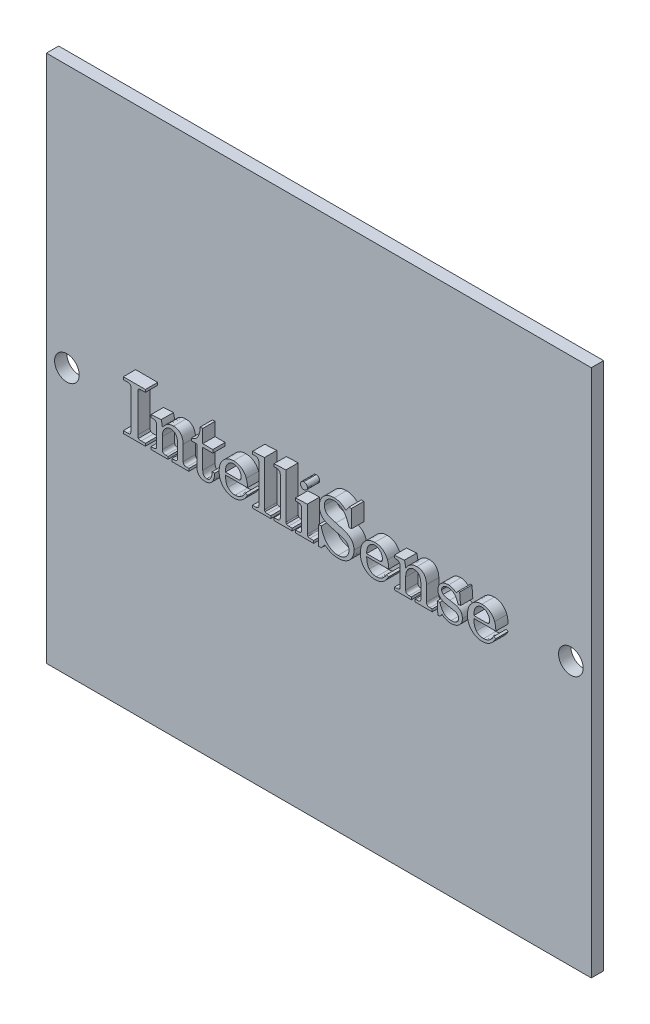
from build123d import *

# Parameters (mm, degrees)
SKETCH1_W           = 66.5
SKETCH1_H           = 64.5
BOSS_EXTRUDE2_DEPTH = 1.5
SKETCH3_R           = 1.5
CUT_EXTRUDE1_DEPTH  = 1.5
BOSS_EXTRUDE3_DEPTH = 1.5


with BuildPart() as part:
    # Sketch1 → Boss-Extrude2 (new body)
    with BuildSketch(Plane.XY):
        Rectangle(SKETCH1_W, SKETCH1_H)
    extrude(amount=BOSS_EXTRUDE2_DEPTH)

    # Sketch3 → Cut-Extrude1 (cut)
    with BuildSketch(Plane.XY.offset(1.5)):
        with Locations((30.75, 0)):
            Circle(SKETCH3_R)
        with Locations((-30.75, 0.23)):
            Circle(SKETCH3_R)
    extrude(amount=-CUT_EXTRUDE1_DEPTH, mode=Mode.SUBTRACT)

    # Sketch4 → Boss-Extrude3 (add)
    # profile 1 of 13: a face of its own
    with BuildSketch(Plane.XY.offset(1.5)):
        with BuildLine():
            Line((-22.363365787, 4.238702658), (-19.671058095, 4.238702658))
            Line((-19.671058095, 4.238702658), (-19.671058095, 3.93101035))
            Line((-19.671058095, 3.93101035), (-20.128990787, 3.93101035))
            add(Edge.make_bspline(
                [(-20.128990787, 3.93101035), (-20.175098097, 3.930262772), (-20.258381223, 3.928912431), (-20.370121238, 3.915820901), (-20.454893023, 3.892736701), (-20.5175512, 3.855995686), (-20.554844239, 3.797873105), (-20.576990501, 3.722906558), (-20.592568436, 3.627542706), (-20.593580414, 3.556489039), (-20.594135018, 3.517548812)],
                knots=[0, 0, 0, 0, 1.473035235, 2.660727346, 3.584016889, 4.269332832, 4.922698946, 5.732321762, 6.757222385, 8, 8, 8, 8], degree=3))
            Line((-20.594135018, 3.517548812), (-20.594135018, -1.019710804))
            add(Edge.make_bspline(
                [(-20.594135018, -1.019710804), (-20.593382305, -1.060684287), (-20.59201952, -1.134866767), (-20.579004957, -1.232769879), (-20.561372788, -1.309424417), (-20.534656268, -1.344739936), (-20.523221556, -1.359855034)],
                knots=[0, 0, 0, 0, 1.387279159, 2.511668523, 3.362991788, 4, 4, 4, 4], degree=3))
            add(Edge.make_bspline(
                [(-20.523221556, -1.359855034), (-20.505044708, -1.374609061), (-20.465743042, -1.406509963), (-20.386587808, -1.432677109), (-20.291372878, -1.451263989), (-20.221277605, -1.452779252), (-20.183077325, -1.453605034)],
                knots=[0, 0, 0, 0, 0.773484526, 1.672414867, 2.731520698, 4, 4, 4, 4], degree=3))
            Line((-20.183077325, -1.453605034), (-19.671058095, -1.453605034))
            Line((-19.671058095, -1.453605034), (-19.671058095, -1.761297342))
            Line((-19.671058095, -1.761297342), (-22.363365787, -1.761297342))
            Line((-22.363365787, -1.761297342), (-22.363365787, -1.453605034))
            Line((-22.363365787, -1.453605034), (-21.860961941, -1.453605034))
            add(Edge.make_bspline(
                [(-21.860961941, -1.453605034), (-21.820835773, -1.453020664), (-21.747817775, -1.45195728), (-21.649392377, -1.436761244), (-21.57312472, -1.413386537), (-21.514341691, -1.376304396), (-21.479784986, -1.315339668), (-21.455506293, -1.237434178), (-21.442463585, -1.135881377), (-21.441061798, -1.060999888), (-21.440288864, -1.019710804)],
                knots=[0, 0, 0, 0, 1.323224596, 2.407885381, 3.273374914, 3.948198526, 4.637756618, 5.528332226, 6.637141158, 8, 8, 8, 8], degree=3))
            Line((-21.440288864, -1.019710804), (-21.440288864, 3.517548812))
            add(Edge.make_bspline(
                [(-21.440288864, 3.517548812), (-21.441274414, 3.556877937), (-21.443040178, 3.6273421), (-21.453341579, 3.72066522), (-21.473310835, 3.791554393), (-21.499129004, 3.823717327), (-21.510000402, 3.83726035)],
                knots=[0, 0, 0, 0, 1.411879347, 2.529598496, 3.380849948, 4, 4, 4, 4], degree=3))
            add(Edge.make_bspline(
                [(-21.510000402, 3.83726035), (-21.531487043, 3.851950673), (-21.578929159, 3.88438664), (-21.67093263, 3.912266983), (-21.783842396, 3.927952688), (-21.866495257, 3.929933283), (-21.91144271, 3.93101035)],
                knots=[0, 0, 0, 0, 0.741247183, 1.636660366, 2.714792252, 4, 4, 4, 4], degree=3))
            Line((-21.91144271, 3.93101035), (-22.363365787, 3.93101035))
            Line((-22.363365787, 3.93101035), (-22.363365787, 4.238702658))
        make_face()
    # profile 2 of 13: a face of its own
    with BuildSketch(Plane.XY.offset(1.5)):
        with BuildLine():
            Line((-18.978750402, 1.93101035), (-17.747981171, 2.007933427))
            add(Edge.make_bspline(
                [(-17.747981171, 2.007933427), (-17.730872836, 1.951627318), (-17.695591554, 1.835511303), (-17.654393941, 1.651889456), (-17.619212783, 1.454594896), (-17.602669816, 1.317728051), (-17.594135018, 1.24711612)],
                knots=[0, 0, 0, 0, 0.90801977, 1.87254349, 2.90240903, 4, 4, 4, 4], degree=3))
            add(Edge.make_bspline(
                [(-17.594135018, 1.24711612), (-17.552082509, 1.313982974), (-17.470628539, 1.443501308), (-17.325318288, 1.613284864), (-17.172599667, 1.760077694), (-17.00635182, 1.879326052), (-16.827892367, 1.971133478), (-16.638951727, 2.038281809), (-16.438275075, 2.077224132), (-16.301032591, 2.082281498), (-16.231154248, 2.084856504)],
                knots=[0, 0, 0, 0, 1.126932948, 2.182822534, 3.182747156, 4.146717341, 5.093755211, 6.040378001, 7.002239436, 8, 8, 8, 8], degree=3))
            add(Edge.make_bspline(
                [(-16.231154248, 2.084856504), (-16.171780056, 2.082894645), (-16.057612528, 2.079122288), (-15.893032813, 2.053607873), (-15.744310139, 2.005717333), (-15.608140725, 1.942501594), (-15.486862583, 1.856193411), (-15.379436137, 1.748798204), (-15.283142193, 1.620976581), (-15.203377035, 1.472455081), (-15.137275198, 1.309327616), (-15.089078671, 1.134814105), (-15.061287435, 0.950333111), (-15.057570332, 0.824533395), (-15.055673479, 0.760337273)],
                knots=[0, 0, 0, 0, 1.066742861, 2.051184042, 2.979875827, 3.865162546, 4.737808188, 5.638610899, 6.584326065, 7.602165992, 8.658000152, 9.740577109, 10.847007032, 12, 12, 12, 12], degree=3))
            Line((-15.055673479, 0.760337273), (-15.055673479, -1.074999265))
            add(Edge.make_bspline(
                [(-15.055673479, -1.074999265), (-15.054708032, -1.106750815), (-15.052905194, -1.166042403), (-15.035072336, -1.248080419), (-15.005594635, -1.316204799), (-14.961420742, -1.370299723), (-14.901153161, -1.407921783), (-14.827820617, -1.435746452), (-14.738093964, -1.45011641), (-14.673503423, -1.452381332), (-14.638606171, -1.453605034)],
                knots=[0, 0, 0, 0, 1.162474339, 2.170758554, 3.057985272, 3.860866192, 4.687699209, 5.631348506, 6.720254899, 8, 8, 8, 8], degree=3))
            Line((-14.638606171, -1.453605034), (-14.363365787, -1.453605034))
            Line((-14.363365787, -1.453605034), (-14.363365787, -1.761297342))
            Line((-14.363365787, -1.761297342), (-16.440288864, -1.761297342))
            Line((-16.440288864, -1.761297342), (-16.440288864, -1.453605034))
            Line((-16.440288864, -1.453605034), (-16.243173479, -1.453605034))
            add(Edge.make_bspline(
                [(-16.243173479, -1.453605034), (-16.200598166, -1.453184861), (-16.121861826, -1.452407817), (-16.014545604, -1.434563956), (-15.925614792, -1.412202688), (-15.857736688, -1.373318305), (-15.806322888, -1.324558016), (-15.77315147, -1.263800939), (-15.751490381, -1.193833044), (-15.749198346, -1.143693139), (-15.747981171, -1.117066573)],
                knots=[0, 0, 0, 0, 1.487387907, 2.75068983, 3.80233843, 4.675424954, 5.458775713, 6.250117506, 7.070732924, 8, 8, 8, 8], degree=3))
            Line((-15.747981171, -1.117066573), (-15.747981171, 0.487500735))
            add(Edge.make_bspline(
                [(-15.747981171, 0.487500735), (-15.748425436, 0.529577436), (-15.74928927, 0.611392041), (-15.756405204, 0.729731676), (-15.768433535, 0.839625852), (-15.784473513, 0.941049579), (-15.808020223, 1.033455306), (-15.833528329, 1.118422453), (-15.866075919, 1.194260023), (-15.891838674, 1.240499049), (-15.904231171, 1.26274112)],
                knots=[0, 0, 0, 0, 1.262126943, 2.454099634, 3.554328132, 4.577771621, 5.530919515, 6.412754846, 7.236497351, 8, 8, 8, 8], degree=3))
            add(Edge.make_bspline(
                [(-15.904231171, 1.26274112), (-15.922741658, 1.291319169), (-15.959019258, 1.347327588), (-16.024873847, 1.420993133), (-16.09705332, 1.484433721), (-16.177650696, 1.535131059), (-16.264735023, 1.575496754), (-16.359281713, 1.602456713), (-16.460474766, 1.619995937), (-16.530354826, 1.62218569), (-16.566490787, 1.623318043)],
                knots=[0, 0, 0, 0, 1.03066891, 2.019946639, 2.98408736, 3.934053301, 4.895820513, 5.883307963, 6.905428821, 8, 8, 8, 8], degree=3))
            add(Edge.make_bspline(
                [(-16.566490787, 1.623318043), (-16.602611551, 1.622115702), (-16.673252766, 1.619764289), (-16.777057386, 1.602630105), (-16.876036519, 1.573289112), (-16.971103635, 1.534022706), (-17.061324763, 1.482493953), (-17.147024899, 1.419824247), (-17.227368178, 1.344600356), (-17.303127959, 1.259659415), (-17.370735123, 1.164907223), (-17.431609156, 1.063666359), (-17.482212449, 0.954851686), (-17.52254028, 0.839062202), (-17.555538907, 0.717083141), (-17.578052439, 0.587957677), (-17.591219429, 0.451718894), (-17.593147864, 0.35852396), (-17.594135018, 0.310818043)],
                knots=[0, 0, 0, 0, 0.931189644, 1.821123375, 2.703772069, 3.588232564, 4.46724645, 5.376399842, 6.319433391, 7.300026525, 8.306400874, 9.31626867, 10.342281956, 11.394383618, 12.474415394, 13.597083543, 14.769961734, 16, 16, 16, 16], degree=3))
            Line((-17.594135018, 0.310818043), (-17.594135018, -1.077403111))
            add(Edge.make_bspline(
                [(-17.594135018, -1.077403111), (-17.593170375, -1.109143231), (-17.591380928, -1.168022332), (-17.573686606, -1.249988425), (-17.542626214, -1.317104918), (-17.498618952, -1.371869137), (-17.437600447, -1.409086218), (-17.363131749, -1.43520498), (-17.273553972, -1.452059203), (-17.208401132, -1.45306543), (-17.173461941, -1.453605034)],
                knots=[0, 0, 0, 0, 1.160250848, 2.152308349, 3.044003165, 3.845348396, 4.682874384, 5.619572326, 6.723459812, 8, 8, 8, 8], degree=3))
            Line((-17.173461941, -1.453605034), (-16.901827325, -1.453605034))
            Line((-16.901827325, -1.453605034), (-16.901827325, -1.761297342))
            Line((-16.901827325, -1.761297342), (-18.978750402, -1.761297342))
            Line((-18.978750402, -1.761297342), (-18.978750402, -1.453605034))
            Line((-18.978750402, -1.453605034), (-18.705913864, -1.453605034))
            add(Edge.make_bspline(
                [(-18.705913864, -1.453605034), (-18.673812243, -1.452753075), (-18.612852427, -1.451135236), (-18.527693212, -1.437408849), (-18.454499277, -1.413165589), (-18.393891795, -1.379878913), (-18.346359872, -1.338548848), (-18.310651186, -1.292041559), (-18.291176465, -1.238665229), (-18.288026425, -1.201737923), (-18.28644271, -1.183172342)],
                knots=[0, 0, 0, 0, 1.384249069, 2.62863887, 3.705237652, 4.695576092, 5.589717584, 6.405434851, 7.198316037, 8, 8, 8, 8], degree=3))
            Line((-18.28644271, -1.183172342), (-18.28644271, 1.152164196))
            add(Edge.make_bspline(
                [(-18.28644271, 1.152164196), (-18.28797039, 1.188763155), (-18.290862108, 1.258040677), (-18.314704539, 1.355277786), (-18.356051566, 1.43817461), (-18.414486371, 1.505717621), (-18.486890067, 1.560438488), (-18.575532491, 1.596592279), (-18.677034284, 1.620254854), (-18.749430675, 1.622259764), (-18.787644633, 1.623318043)],
                knots=[0, 0, 0, 0, 1.11888944, 2.117926075, 3.03900458, 3.925918627, 4.828204364, 5.789209299, 6.83304868, 8, 8, 8, 8], degree=3))
            Line((-18.787644633, 1.623318043), (-18.978750402, 1.623318043))
            Line((-18.978750402, 1.623318043), (-18.978750402, 1.93101035))
        make_face()
    # profile 3 of 13: a face of its own
    with BuildSketch(Plane.XY.offset(1.5)):
        with BuildLine():
            Line((-12.978750402, 3.623318043), (-12.671058095, 3.623318043))
            Line((-12.671058095, 3.623318043), (-12.671058095, 2.007933427))
            Line((-12.671058095, 2.007933427), (-11.440288864, 2.007933427))
            Line((-11.440288864, 2.007933427), (-11.440288864, 1.623318043))
            Line((-11.440288864, 1.623318043), (-12.671058095, 1.623318043))
            Line((-12.671058095, 1.623318043), (-12.671058095, -0.80336465))
            add(Edge.make_bspline(
                [(-12.671058095, -0.80336465), (-12.669730506, -0.852771666), (-12.667215211, -0.946379849), (-12.640896836, -1.078155421), (-12.596479584, -1.192041511), (-12.535089112, -1.287491387), (-12.458694509, -1.361386017), (-12.371948034, -1.415211369), (-12.275017764, -1.447451781), (-12.206954104, -1.451527512), (-12.172260018, -1.453605034)],
                knots=[0, 0, 0, 0, 1.286365923, 2.437191868, 3.482267608, 4.455333307, 5.370964169, 6.228746245, 7.097138898, 8, 8, 8, 8], degree=3))
            add(Edge.make_bspline(
                [(-12.172260018, -1.453605034), (-12.130103034, -1.450763893), (-12.046640026, -1.44513896), (-11.927977871, -1.394036548), (-11.820532361, -1.313397192), (-11.74181013, -1.222818738), (-11.685448906, -1.134795048), (-11.645530383, -1.056613605), (-11.612727749, -0.967153489), (-11.583785481, -0.868368266), (-11.560470065, -0.759766722), (-11.539343728, -0.641669502), (-11.525506302, -0.512739345), (-11.520046654, -0.423181454), (-11.517211941, -0.376681957)],
                knots=[0, 0, 0, 0, 1.086381989, 2.150834791, 3.284830626, 4.54074591, 5.230798836, 5.986401188, 6.806506628, 7.692119574, 8.647754445, 9.678725639, 10.794767395, 12, 12, 12, 12], degree=3))
            Line((-11.517211941, -0.376681957), (-11.209519633, -0.376681957))
            add(Edge.make_bspline(
                [(-11.209519633, -0.376681957), (-11.21244515, -0.436828303), (-11.218094649, -0.552977577), (-11.237395131, -0.721222066), (-11.265459855, -0.877267516), (-11.304480728, -1.021323418), (-11.350700909, -1.1540425), (-11.406809216, -1.274910696), (-11.473890225, -1.382727706), (-11.548123749, -1.479308028), (-11.630622389, -1.563652481), (-11.718298214, -1.637722055), (-11.813029242, -1.699327079), (-11.913380679, -1.750051435), (-12.019620701, -1.790240428), (-12.132311405, -1.817364451), (-12.250649659, -1.83471971), (-12.331652756, -1.837037741), (-12.372981171, -1.838220419)],
                knots=[0, 0, 0, 0, 1.37429505, 2.653916371, 3.86292504, 4.989903966, 6.057268808, 7.067797023, 8.024629965, 8.950272242, 9.842792516, 10.712819428, 11.565121037, 12.415851039, 13.275383954, 14.15154194, 15.056902215, 16, 16, 16, 16], degree=3))
            add(Edge.make_bspline(
                [(-12.372981171, -1.838220419), (-12.410673433, -1.837647455), (-12.484259337, -1.836528869), (-12.591656293, -1.824339645), (-12.692512556, -1.803926255), (-12.787283077, -1.776446093), (-12.875624335, -1.740333144), (-12.957417299, -1.695394682), (-13.033988356, -1.644080405), (-13.102021434, -1.583377484), (-13.164062345, -1.517568762), (-13.216105717, -1.444791455), (-13.263411461, -1.369084694), (-13.29850307, -1.286316835), (-13.328087373, -1.199722851), (-13.347711823, -1.107704272), (-13.362100504, -1.011348019), (-13.362938432, -0.945249114), (-13.363365787, -0.911537727)],
                knots=[0, 0, 0, 0, 1.180250654, 2.304181497, 3.379708284, 4.400235503, 5.390689928, 6.362200364, 7.319421302, 8.270949112, 9.212242905, 10.145977333, 11.069280541, 12.002002425, 12.954440114, 13.931768998, 14.945172571, 16, 16, 16, 16], degree=3))
            Line((-13.363365787, -0.911537727), (-13.363365787, 1.623318043))
            Line((-13.363365787, 1.623318043), (-14.055673479, 1.623318043))
            Line((-14.055673479, 1.623318043), (-14.055673479, 1.91538535))
            add(Edge.make_bspline(
                [(-14.055673479, 1.91538535), (-14.01867046, 1.922799421), (-13.945979817, 1.937364005), (-13.842010169, 1.968832354), (-13.744037574, 2.006291151), (-13.653215587, 2.051396776), (-13.569432397, 2.105138384), (-13.492299652, 2.16516693), (-13.421779842, 2.232559508), (-13.381259418, 2.283098314), (-13.360961941, 2.308414196)],
                knots=[0, 0, 0, 0, 1.107126961, 2.174897374, 3.183803972, 4.183001041, 5.145328111, 6.100371003, 7.048438443, 8, 8, 8, 8], degree=3))
            add(Edge.make_bspline(
                [(-13.360961941, 2.308414196), (-13.332506958, 2.349169071), (-13.274780244, 2.431848617), (-13.201828226, 2.567903401), (-13.137805117, 2.714852272), (-13.085096091, 2.874229618), (-13.043620778, 3.045216344), (-13.011371496, 3.227467411), (-12.987983831, 3.421265251), (-12.981884163, 3.554742748), (-12.978750402, 3.623318043)],
                knots=[0, 0, 0, 0, 0.857430404, 1.739471824, 2.659418563, 3.621727729, 4.633207464, 5.694103701, 6.815324515, 8, 8, 8, 8], degree=3))
        make_face()
    # profile 4 of 13: a face of its own
    with BuildSketch(Plane.XY.offset(1.5)):
        with BuildLine():
            Line((-7.209519633, 0.084856504), (-9.901827325, 0.084856504))
            add(Edge.make_bspline(
                [(-9.901827325, 0.084856504), (-9.899327336, 0.019104484), (-9.894501794, -0.107811724), (-9.876112663, -0.290720543), (-9.851152287, -0.458923131), (-9.813839356, -0.611474506), (-9.772567798, -0.750000694), (-9.718662671, -0.872385553), (-9.658330742, -0.98106702), (-9.608608851, -1.043533592), (-9.584519633, -1.073797342)],
                knots=[0, 0, 0, 0, 1.290560015, 2.49107151, 3.604964235, 4.622998674, 5.57014379, 6.436056147, 7.242301845, 8, 8, 8, 8], degree=3))
            add(Edge.make_bspline(
                [(-9.584519633, -1.073797342), (-9.555485065, -1.104100933), (-9.498457943, -1.163620558), (-9.403277726, -1.240699671), (-9.303654536, -1.308323042), (-9.195956142, -1.359772792), (-9.084472199, -1.403864884), (-8.965750325, -1.431308738), (-8.841949097, -1.450403208), (-8.757272882, -1.452527599), (-8.714327325, -1.453605034)],
                knots=[0, 0, 0, 0, 1.027343628, 2.017817225, 2.995264795, 3.969898424, 4.936190664, 5.926664261, 6.948458453, 8, 8, 8, 8], degree=3))
            add(Edge.make_bspline(
                [(-8.714327325, -1.453605034), (-8.65080944, -1.451164359), (-8.525696797, -1.446356905), (-8.343265632, -1.405143438), (-8.170599495, -1.338558262), (-8.0078709, -1.244611813), (-7.855351429, -1.123595208), (-7.711931366, -0.977199584), (-7.578834952, -0.803757064), (-7.502616008, -0.674448579), (-7.463125402, -0.607451188)],
                knots=[0, 0, 0, 0, 0.95761279, 1.886231972, 2.806944167, 3.741371445, 4.710218059, 5.73632874, 6.82714527, 8, 8, 8, 8], degree=3))
            Line((-7.463125402, -0.607451188), (-7.209519633, -0.713220419))
            add(Edge.make_bspline(
                [(-7.209519633, -0.713220419), (-7.233815454, -0.758804764), (-7.281648675, -0.848550486), (-7.361561239, -0.975622259), (-7.443908279, -1.094891319), (-7.531395186, -1.204949738), (-7.621573348, -1.307038652), (-7.718009688, -1.398938067), (-7.816962118, -1.48326331), (-7.921081203, -1.557702952), (-8.028042443, -1.624879715), (-8.140697542, -1.680394587), (-8.255424669, -1.731032716), (-8.375971397, -1.768498069), (-8.499270459, -1.800591038), (-8.627623021, -1.821644733), (-8.759704817, -1.835294534), (-8.849308591, -1.837237818), (-8.894615787, -1.838220419)],
                knots=[0, 0, 0, 0, 1.156407444, 2.276716275, 3.359389408, 4.400483603, 5.423482642, 6.407006449, 7.381155316, 8.332351287, 9.27102481, 10.205917502, 11.142487673, 12.075958605, 13.029056758, 13.993697862, 14.985534663, 16, 16, 16, 16], degree=3))
            add(Edge.make_bspline(
                [(-8.894615787, -1.838220419), (-8.956000214, -1.836648631), (-9.076898349, -1.833552955), (-9.254147832, -1.807768742), (-9.424023377, -1.765380884), (-9.586686151, -1.706803522), (-9.741225263, -1.629988239), (-9.889368956, -1.538475533), (-10.028833145, -1.427999928), (-10.16034864, -1.302751209), (-10.279583523, -1.164031919), (-10.385297821, -1.015754816), (-10.473645026, -0.856788107), (-10.545068531, -0.688518004), (-10.602843792, -0.511414734), (-10.64148411, -0.324343461), (-10.666214855, -0.12814432), (-10.669424732, 0.005853654), (-10.671058095, 0.074039196)],
                knots=[0, 0, 0, 0, 1.009376893, 1.98799256, 2.93903604, 3.885524611, 4.825728588, 5.772996936, 6.744642048, 7.746828986, 8.756162849, 9.749054053, 10.737385458, 11.741196248, 12.752013589, 13.796411062, 14.878692697, 16, 16, 16, 16], degree=3))
            add(Edge.make_bspline(
                [(-10.671058095, 0.074039196), (-10.669420219, 0.147422707), (-10.666215912, 0.290988788), (-10.64186556, 0.500473376), (-10.602140795, 0.699083734), (-10.547383452, 0.887397259), (-10.474753379, 1.06475558), (-10.386780522, 1.231554927), (-10.282844211, 1.387390551), (-10.164340383, 1.531077908), (-10.033737466, 1.660088769), (-9.894973843, 1.774316189), (-9.748207992, 1.87043744), (-9.594230251, 1.949925228), (-9.432491159, 2.009561973), (-9.263841178, 2.053143677), (-9.087818327, 2.080510215), (-8.967632485, 2.083393275), (-8.906635018, 2.084856504)],
                knots=[0, 0, 0, 0, 1.176453707, 2.301591277, 3.376245917, 4.421051583, 5.44101377, 6.443920987, 7.439891301, 8.4392535, 9.424978133, 10.379132977, 11.316334288, 12.232831498, 13.15162226, 14.07402163, 15.022515458, 16, 16, 16, 16], degree=3))
            add(Edge.make_bspline(
                [(-8.906635018, 2.084856504), (-8.861749743, 2.083702855), (-8.773424792, 2.081432712), (-8.642596124, 2.070326054), (-8.517215117, 2.046504418), (-8.395487939, 2.017149909), (-8.279776067, 1.976928712), (-8.167236193, 1.930450607), (-8.061273987, 1.871927011), (-7.958388141, 1.807707984), (-7.862435273, 1.733375621), (-7.770383621, 1.653559809), (-7.686495923, 1.563763746), (-7.608100552, 1.467432649), (-7.535610669, 1.363493235), (-7.469587569, 1.251877292), (-7.410730726, 1.132120646), (-7.376142613, 1.048993273), (-7.358558095, 1.006731504)],
                knots=[0, 0, 0, 0, 1.067989176, 2.101582129, 3.118433834, 4.100716547, 5.077111027, 6.02935025, 6.992965556, 7.952614574, 8.911316818, 9.876815107, 10.84751954, 11.829802252, 12.829087319, 13.85871895, 14.911377547, 16, 16, 16, 16], degree=3))
            add(Edge.make_bspline(
                [(-7.358558095, 1.006731504), (-7.336262297, 0.942238051), (-7.289602373, 0.807268235), (-7.246555236, 0.587108765), (-7.217038657, 0.344055666), (-7.212102679, 0.173900441), (-7.209519633, 0.084856504)],
                knots=[0, 0, 0, 0, 0.871715335, 1.824297686, 2.861433147, 4, 4, 4, 4], degree=3))
        make_face()
        with BuildLine():
            Line((-9.901827325, 0.392548812), (-8.281635018, 0.392548812))
            add(Edge.make_bspline(
                [(-8.281635018, 0.392548812), (-8.259101566, 0.393723918), (-8.215757955, 0.395984263), (-8.154253692, 0.412651075), (-8.101401284, 0.442329928), (-8.055896891, 0.483493764), (-8.020546424, 0.539843343), (-7.996145195, 0.611273146), (-7.980580261, 0.697575314), (-7.97939059, 0.76025945), (-7.978750402, 0.79399112)],
                knots=[0, 0, 0, 0, 0.941514904, 1.811025533, 2.635677735, 3.453500402, 4.35000608, 5.382986957, 6.591729515, 8, 8, 8, 8], degree=3))
            add(Edge.make_bspline(
                [(-7.978750402, 0.79399112), (-7.9798579, 0.827672235), (-7.982027162, 0.893643647), (-7.993671276, 0.990821357), (-8.015734316, 1.083676843), (-8.045743734, 1.173098054), (-8.084575245, 1.258729055), (-8.131097031, 1.341137761), (-8.188611132, 1.417715067), (-8.251646833, 1.490865417), (-8.320857138, 1.557635697), (-8.393907532, 1.616620696), (-8.469932902, 1.666345072), (-8.549012885, 1.706432907), (-8.631201125, 1.737794882), (-8.71650114, 1.76080516), (-8.805252486, 1.774193741), (-8.865324649, 1.776164052), (-8.89581771, 1.777164196)],
                knots=[0, 0, 0, 0, 1.083752029, 2.122751857, 3.1418195, 4.148425025, 5.152056332, 6.162285122, 7.185581279, 8.226976039, 9.265975868, 10.274312303, 11.242998299, 12.182439434, 13.120642251, 14.067830033, 15.019216674, 16, 16, 16, 16], degree=3))
            add(Edge.make_bspline(
                [(-8.89581771, 1.777164196), (-8.929965381, 1.776531413), (-8.997099745, 1.77528736), (-9.095532431, 1.756676207), (-9.190935394, 1.731569363), (-9.281135395, 1.692026555), (-9.368130478, 1.643487913), (-9.450340966, 1.583242826), (-9.529549087, 1.512706829), (-9.603430756, 1.431485619), (-9.671582262, 1.339150689), (-9.731244433, 1.23601558), (-9.782472976, 1.121762911), (-9.822002955, 0.996328547), (-9.856323254, 0.860839136), (-9.881106291, 0.714574398), (-9.896692656, 0.55713026), (-9.900076281, 0.448674998), (-9.901827325, 0.392548812)],
                knots=[0, 0, 0, 0, 0.854703501, 1.680348146, 2.504035414, 3.323055166, 4.141582052, 4.997465105, 5.872465976, 6.796752527, 7.744960926, 8.744146263, 9.778261987, 10.877266721, 12.03684134, 13.280257338, 14.592518417, 16, 16, 16, 16], degree=3))
        make_face(mode=Mode.SUBTRACT)
    # profile 5 of 13: a face of its own
    with BuildSketch(Plane.XY.offset(1.5)):
        with BuildLine():
            Line((-5.132596556, 4.315625735), (-5.132596556, -1.197595419))
            add(Edge.make_bspline(
                [(-5.132596556, -1.197595419), (-5.131676452, -1.215712531), (-5.129931068, -1.250079669), (-5.116769341, -1.298341012), (-5.093353317, -1.340011387), (-5.070717495, -1.361178288), (-5.059279248, -1.371874265)],
                knots=[0, 0, 0, 0, 1.110862131, 2.107242669, 3.043559135, 4, 4, 4, 4], degree=3))
            add(Edge.make_bspline(
                [(-5.059279248, -1.371874265), (-5.04047932, -1.384699739), (-5.002744989, -1.410442425), (-4.93770637, -1.434673474), (-4.867846496, -1.451597471), (-4.819009326, -1.452918953), (-4.793654248, -1.453605034)],
                knots=[0, 0, 0, 0, 0.962638127, 1.932161952, 2.926428514, 4, 4, 4, 4], degree=3))
            Line((-4.793654248, -1.453605034), (-4.363365787, -1.453605034))
            Line((-4.363365787, -1.453605034), (-4.363365787, -1.761297342))
            Line((-4.363365787, -1.761297342), (-6.594135018, -1.761297342))
            Line((-6.594135018, -1.761297342), (-6.594135018, -1.453605034))
            Line((-6.594135018, -1.453605034), (-6.203510018, -1.453605034))
            add(Edge.make_bspline(
                [(-6.203510018, -1.453605034), (-6.173781378, -1.452473528), (-6.117401679, -1.450327653), (-6.03873773, -1.433956091), (-5.971845917, -1.406253683), (-5.916927421, -1.367112317), (-5.875900651, -1.316212848), (-5.844475261, -1.257404577), (-5.828310122, -1.188004757), (-5.826079016, -1.139172802), (-5.824904248, -1.113460804)],
                knots=[0, 0, 0, 0, 1.228310972, 2.329464226, 3.301499717, 4.202517503, 5.084616193, 5.980903394, 6.93686402, 8, 8, 8, 8], degree=3))
            Line((-5.824904248, -1.113460804), (-5.824904248, 3.505529581))
            add(Edge.make_bspline(
                [(-5.824904248, 3.505529581), (-5.825742801, 3.537322078), (-5.827311068, 3.59678065), (-5.846890659, 3.679094817), (-5.878247261, 3.749447796), (-5.911972205, 3.78434078), (-5.928269633, 3.801202658)],
                knots=[0, 0, 0, 0, 1.179927524, 2.206709521, 3.133400395, 4, 4, 4, 4], degree=3))
            add(Edge.make_bspline(
                [(-5.928269633, 3.801202658), (-5.952432105, 3.82102078), (-6.000205881, 3.860204952), (-6.084387202, 3.901900981), (-6.176915727, 3.92613285), (-6.241424943, 3.929359708), (-6.274423479, 3.93101035)],
                knots=[0, 0, 0, 0, 0.988850177, 1.955143721, 2.953990337, 4, 4, 4, 4], degree=3))
            Line((-6.274423479, 3.93101035), (-6.594135018, 3.93101035))
            Line((-6.594135018, 3.93101035), (-6.594135018, 4.238702658))
            Line((-6.594135018, 4.238702658), (-5.132596556, 4.315625735))
        make_face()
    # profile 6 of 13: a face of its own
    with BuildSketch(Plane.XY.offset(1.5)):
        with BuildLine():
            Line((-2.517211941, 4.315625735), (-2.517211941, -1.197595419))
            add(Edge.make_bspline(
                [(-2.517211941, -1.197595419), (-2.516291837, -1.215712531), (-2.514546452, -1.250079669), (-2.501384726, -1.298341012), (-2.477968702, -1.340011387), (-2.45533288, -1.361178288), (-2.443894633, -1.371874265)],
                knots=[0, 0, 0, 0, 1.110862131, 2.107242669, 3.043559135, 4, 4, 4, 4], degree=3))
            add(Edge.make_bspline(
                [(-2.443894633, -1.371874265), (-2.425094705, -1.384699739), (-2.387360373, -1.410442425), (-2.322321755, -1.434673474), (-2.25246188, -1.451597471), (-2.20362471, -1.452918953), (-2.178269633, -1.453605034)],
                knots=[0, 0, 0, 0, 0.962638127, 1.932161952, 2.926428514, 4, 4, 4, 4], degree=3))
            Line((-2.178269633, -1.453605034), (-1.747981171, -1.453605034))
            Line((-1.747981171, -1.453605034), (-1.747981171, -1.761297342))
            Line((-1.747981171, -1.761297342), (-3.978750402, -1.761297342))
            Line((-3.978750402, -1.761297342), (-3.978750402, -1.453605034))
            Line((-3.978750402, -1.453605034), (-3.588125402, -1.453605034))
            add(Edge.make_bspline(
                [(-3.588125402, -1.453605034), (-3.558396763, -1.452473528), (-3.502017064, -1.450327653), (-3.423353114, -1.433956091), (-3.356461301, -1.406253683), (-3.301542805, -1.367112317), (-3.260516036, -1.316212848), (-3.229090645, -1.257404577), (-3.212925507, -1.188004757), (-3.210694401, -1.139172802), (-3.209519633, -1.113460804)],
                knots=[0, 0, 0, 0, 1.228310972, 2.329464226, 3.301499717, 4.202517503, 5.084616193, 5.980903394, 6.93686402, 8, 8, 8, 8], degree=3))
            Line((-3.209519633, -1.113460804), (-3.209519633, 3.505529581))
            add(Edge.make_bspline(
                [(-3.209519633, 3.505529581), (-3.210358185, 3.537322078), (-3.211926452, 3.59678065), (-3.231506044, 3.679094817), (-3.262862645, 3.749447796), (-3.296587589, 3.78434078), (-3.312885018, 3.801202658)],
                knots=[0, 0, 0, 0, 1.179927524, 2.206709521, 3.133400395, 4, 4, 4, 4], degree=3))
            add(Edge.make_bspline(
                [(-3.312885018, 3.801202658), (-3.33704749, 3.82102078), (-3.384821265, 3.860204952), (-3.469002586, 3.901900981), (-3.561531112, 3.92613285), (-3.626040328, 3.929359708), (-3.659038864, 3.93101035)],
                knots=[0, 0, 0, 0, 0.988850177, 1.955143721, 2.953990337, 4, 4, 4, 4], degree=3))
            Line((-3.659038864, 3.93101035), (-3.978750402, 3.93101035))
            Line((-3.978750402, 3.93101035), (-3.978750402, 4.238702658))
            Line((-3.978750402, 4.238702658), (-2.517211941, 4.315625735))
        make_face()
    # profile 7 of 13: a face of its own
    with BuildSketch(Plane.XY.offset(1.5)):
        with BuildLine():
            add(Edge.make_bspline(
                [(-0.327308095, 4.161779581), (-0.299870906, 4.160138678), (-0.245521166, 4.156888249), (-0.167118737, 4.131370229), (-0.093373608, 4.091437149), (-0.029224684, 4.03437698), (0.027803064, 3.970226527), (0.068043881, 3.896179259), (0.093369858, 3.816456652), (0.096553772, 3.760927535), (0.098172675, 3.732693043)],
                knots=[0, 0, 0, 0, 0.984626563, 1.950425691, 2.936736457, 3.978791157, 5.020845856, 6.007156623, 6.986713202, 8, 8, 8, 8], degree=3))
            add(Edge.make_bspline(
                [(0.098172675, 3.732693043), (0.097096214, 3.705227205), (0.094977444, 3.651166922), (0.068666481, 3.573974809), (0.030321484, 3.501206868), (-0.025267017, 3.438182482), (-0.088974188, 3.383556556), (-0.161653683, 3.344805026), (-0.239825859, 3.318872044), (-0.294646205, 3.316719461), (-0.322500402, 3.315625735)],
                knots=[0, 0, 0, 0, 0.999946733, 1.968168695, 2.951344777, 3.990437309, 5.020091364, 6.003267447, 6.985460953, 8, 8, 8, 8], degree=3))
            add(Edge.make_bspline(
                [(-0.322500402, 3.315625735), (-0.350702937, 3.317332104), (-0.405669455, 3.320657803), (-0.485393695, 3.344408022), (-0.558293454, 3.38505364), (-0.62353338, 3.44009075), (-0.678179807, 3.505123559), (-0.719218327, 3.576933555), (-0.742819442, 3.655132991), (-0.746238875, 3.708901995), (-0.747981171, 3.736298812)],
                knots=[0, 0, 0, 0, 1.021863716, 1.991604295, 2.986263642, 4.027760715, 5.069257788, 6.05121452, 7.007039112, 8, 8, 8, 8], degree=3))
            add(Edge.make_bspline(
                [(-0.747981171, 3.736298812), (-0.746335323, 3.763731887), (-0.743075097, 3.81807348), (-0.717629983, 3.896536541), (-0.677534874, 3.969814734), (-0.621847385, 4.034758445), (-0.55758962, 4.091440875), (-0.484519069, 4.130809193), (-0.407594707, 4.157093996), (-0.354367369, 4.160200382), (-0.327308095, 4.161779581)],
                knots=[0, 0, 0, 0, 0.996270549, 1.973491012, 2.971465681, 4.016434192, 5.07081201, 6.068786679, 7.018225727, 8, 8, 8, 8], degree=3))
        make_face()
    # profile 8 of 13: a face of its own
    with BuildSketch(Plane.XY.offset(1.5)):
        with BuildLine():
            Line((-1.363365787, 1.93101035), (0.098172675, 2.007933427))
            Line((0.098172675, 2.007933427), (0.098172675, -1.187980034))
            add(Edge.make_bspline(
                [(0.098172675, -1.187980034), (0.099143012, -1.208484285), (0.100932274, -1.246293272), (0.112607847, -1.298842718), (0.133904823, -1.342661601), (0.156004157, -1.36397819), (0.16668229, -1.374278111)],
                knots=[0, 0, 0, 0, 1.200262611, 2.213234447, 3.136656251, 4, 4, 4, 4], degree=3))
            add(Edge.make_bspline(
                [(0.16668229, -1.374278111), (0.183857342, -1.386716358), (0.218281504, -1.411646483), (0.279141348, -1.43461348), (0.344434852, -1.451566209), (0.390516033, -1.452911379), (0.414278444, -1.453605034)],
                knots=[0, 0, 0, 0, 0.9568273, 1.917780357, 2.926274087, 4, 4, 4, 4], degree=3))
            Line((0.414278444, -1.453605034), (0.867403444, -1.453605034))
            Line((0.867403444, -1.453605034), (0.867403444, -1.761297342))
            Line((0.867403444, -1.761297342), (-1.363365787, -1.761297342))
            Line((-1.363365787, -1.761297342), (-1.363365787, -1.453605034))
            Line((-1.363365787, -1.453605034), (-0.949904248, -1.453605034))
            add(Edge.make_bspline(
                [(-0.949904248, -1.453605034), (-0.921338278, -1.453051967), (-0.867239817, -1.452004565), (-0.793174703, -1.434696146), (-0.729461956, -1.409964807), (-0.679411524, -1.371335969), (-0.639399801, -1.323625886), (-0.613735498, -1.265148916), (-0.595592641, -1.198685301), (-0.594640487, -1.150865902), (-0.594135018, -1.125480034)],
                knots=[0, 0, 0, 0, 1.2325627, 2.334237022, 3.274198502, 4.165098485, 5.039491013, 5.938948665, 6.905850397, 8, 8, 8, 8], degree=3))
            Line((-0.594135018, -1.125480034), (-0.594135018, 1.18101035))
            add(Edge.make_bspline(
                [(-0.594135018, 1.18101035), (-0.59522392, 1.215609062), (-0.59727783, 1.280869876), (-0.62035816, 1.372290994), (-0.659306383, 1.449996065), (-0.713640683, 1.514323005), (-0.782767743, 1.564704918), (-0.867092208, 1.599675016), (-0.965426649, 1.619373609), (-1.035549233, 1.621956818), (-1.072500402, 1.623318043)],
                knots=[0, 0, 0, 0, 1.112952045, 2.099273426, 3.011503497, 3.890895661, 4.786903737, 5.741277924, 6.809764049, 8, 8, 8, 8], degree=3))
            Line((-1.072500402, 1.623318043), (-1.363365787, 1.623318043))
            Line((-1.363365787, 1.623318043), (-1.363365787, 1.93101035))
        make_face()
    # profile 9 of 13: a face of its own
    with BuildSketch(Plane.XY.offset(1.5)):
        with BuildLine():
            Line((4.80730729, 3.70024112), (5.175095752, 4.238702658))
            Line((5.175095752, 4.238702658), (5.482788059, 4.238702658))
            Line((5.482788059, 4.238702658), (5.482788059, 2.084856504))
            Line((5.482788059, 2.084856504), (5.175095752, 2.084856504))
            add(Edge.make_bspline(
                [(5.175095752, 2.084856504), (5.154226854, 2.165599429), (5.113570473, 2.322901234), (5.041647819, 2.548485913), (4.962390473, 2.757230371), (4.876067858, 2.948922133), (4.782335418, 3.123774348), (4.681613119, 3.282443972), (4.57193937, 3.423135712), (4.456206199, 3.547985974), (4.334115843, 3.656301885), (4.208046765, 3.751066308), (4.075967302, 3.828892385), (3.940939378, 3.894853908), (3.800695541, 3.945516849), (3.655724205, 3.981543717), (3.506317442, 4.003850533), (3.405140098, 4.006565858), (3.35418229, 4.007933427)],
                knots=[0, 0, 0, 0, 1.392564724, 2.712967664, 3.951873449, 5.119722724, 6.221370984, 7.262600271, 8.254348041, 9.196438926, 10.101595302, 10.976777585, 11.825919055, 12.65785703, 13.483312273, 14.310934069, 15.149304651, 16, 16, 16, 16], degree=3))
            add(Edge.make_bspline(
                [(3.35418229, 4.007933427), (3.312081061, 4.006998002), (3.229227186, 4.005157116), (3.107969994, 3.991051812), (2.992666519, 3.965242057), (2.883070223, 3.930670343), (2.779222275, 3.885930913), (2.680936053, 3.831792975), (2.589526217, 3.766282317), (2.504540004, 3.692254155), (2.428334013, 3.610763218), (2.360327402, 3.525034902), (2.302214152, 3.435294877), (2.256362342, 3.340116686), (2.220101331, 3.241075379), (2.193655447, 3.137661084), (2.177461502, 3.029681236), (2.175893307, 2.956307623), (2.175095752, 2.91899112)],
                knots=[0, 0, 0, 0, 1.126750777, 2.217409579, 3.260704063, 4.284866151, 5.288787342, 6.282404548, 7.282136379, 8.292906458, 9.294247238, 10.263909872, 11.218754854, 12.149141496, 13.085441672, 14.037331684, 15.001822113, 16, 16, 16, 16], degree=3))
            add(Edge.make_bspline(
                [(2.175095752, 2.91899112), (2.17613689, 2.872784706), (2.178162179, 2.782901074), (2.203931573, 2.652724696), (2.241390063, 2.530597103), (2.296230422, 2.417642577), (2.366258242, 2.314367451), (2.453511852, 2.222207518), (2.554700259, 2.139223494), (2.651895391, 2.078231016), (2.742318178, 2.034428422), (2.824535411, 1.999505119), (2.92058293, 1.964046755), (3.029775428, 1.926454753), (3.152952811, 1.890176159), (3.288677705, 1.84953524), (3.438885919, 1.810689012), (3.543663948, 1.784683462), (3.598172675, 1.771154581)],
                knots=[0, 0, 0, 0, 1.100069853, 2.139925311, 3.152029683, 4.138980986, 5.121994753, 6.115535174, 7.15398554, 8.235440347, 8.84210157, 9.54830075, 10.364495047, 11.282859591, 12.301255968, 13.425815379, 14.660830642, 16, 16, 16, 16], degree=3))
            add(Edge.make_bspline(
                [(3.598172675, 1.771154581), (3.675141649, 1.751704188), (3.823720958, 1.714157552), (4.037561516, 1.657009324), (4.234243604, 1.599011788), (4.413826229, 1.541826036), (4.576782535, 1.484885088), (4.7232372, 1.430594565), (4.85249721, 1.375389172), (4.999142689, 1.302632861), (5.161749947, 1.20830302), (5.330687847, 1.076970772), (5.474607908, 0.932647388), (5.589863194, 0.771735053), (5.679737148, 0.597531863), (5.745700833, 0.409748147), (5.782672307, 0.20649272), (5.787830973, 0.066572603), (5.790480367, -0.005287727)],
                knots=[0, 0, 0, 0, 1.232165093, 2.378545896, 3.435149422, 4.414474693, 5.303353997, 6.114110724, 6.838339871, 7.483508315, 8.654450536, 9.749016275, 10.7955263, 11.806804694, 12.808015395, 13.828656267, 14.884838868, 16, 16, 16, 16], degree=3))
            add(Edge.make_bspline(
                [(5.790480367, -0.005287727), (5.788939394, -0.06988041), (5.78591221, -0.196770339), (5.75982962, -0.382697204), (5.718487804, -0.560657408), (5.657323434, -0.729295555), (5.581961958, -0.890805741), (5.487018343, -1.04221435), (5.377248451, -1.186686084), (5.250401272, -1.320101282), (5.110198546, -1.441160917), (4.959231586, -1.54747318), (4.798815522, -1.638177652), (4.628046588, -1.712096115), (4.446908265, -1.768055359), (4.256347022, -1.809142531), (4.055924066, -1.833288388), (3.91915139, -1.836554274), (3.849374598, -1.838220419)],
                knots=[0, 0, 0, 0, 1.035674451, 2.034544032, 3.00567608, 3.961072093, 4.906865893, 5.859230957, 6.821991021, 7.813035652, 8.806369794, 9.78881277, 10.770098954, 11.757427494, 12.767644959, 13.806306077, 14.880851562, 16, 16, 16, 16], degree=3))
            add(Edge.make_bspline(
                [(3.849374598, -1.838220419), (3.773554578, -1.836452915), (3.6241565, -1.832970171), (3.403739083, -1.802894736), (3.191055761, -1.755650698), (2.986043638, -1.687211191), (2.788519079, -1.600966188), (2.599003055, -1.494011166), (2.416193596, -1.36912151), (2.303230452, -1.27202157), (2.246009213, -1.222835804)],
                knots=[0, 0, 0, 0, 1.034489663, 2.038389989, 3.030740084, 4.004349409, 4.983823211, 5.968063708, 6.970727015, 8, 8, 8, 8], degree=3))
            Line((2.246009213, -1.222835804), (1.790480367, -1.761297342))
            Line((1.790480367, -1.761297342), (1.482788059, -1.761297342))
            Line((1.482788059, -1.761297342), (1.482788059, 0.546394966))
            Line((1.482788059, 0.546394966), (1.790480367, 0.546394966))
            add(Edge.make_bspline(
                [(1.790480367, 0.546394966), (1.805343885, 0.468004083), (1.834464379, 0.314421243), (1.897061481, 0.09273685), (1.969406689, -0.117639283), (2.057580832, -0.314608653), (2.157359836, -0.49921152), (2.269547188, -0.671515598), (2.396013823, -0.829990005), (2.534133418, -0.975391056), (2.680857803, -1.105233842), (2.832757728, -1.219376403), (2.990158619, -1.315238474), (3.152322683, -1.392800566), (3.318402101, -1.45581088), (3.489932223, -1.498223352), (3.665768421, -1.526099027), (3.784764801, -1.529046731), (3.844566905, -1.530528111)],
                knots=[0, 0, 0, 0, 1.203557391, 2.358000753, 3.472814881, 4.558186921, 5.610607053, 6.636911962, 7.656713516, 8.666011679, 9.659686897, 10.610151865, 11.529909132, 12.435830157, 13.319692086, 14.205413257, 15.098123285, 16, 16, 16, 16], degree=3))
            add(Edge.make_bspline(
                [(3.844566905, -1.530528111), (3.892276699, -1.529183053), (3.985947337, -1.526542245), (4.123279066, -1.511449637), (4.253924223, -1.483369358), (4.377927099, -1.445055998), (4.495619836, -1.396024208), (4.604987466, -1.333526696), (4.709571408, -1.263063563), (4.80450513, -1.180140228), (4.890804849, -1.090303828), (4.967189939, -0.995411157), (5.031064818, -0.894762832), (5.084543624, -0.789985562), (5.125590366, -0.679877368), (5.154323181, -0.565390787), (5.171539602, -0.446113944), (5.173894344, -0.36512072), (5.175095752, -0.323797342)],
                knots=[0, 0, 0, 0, 1.141184085, 2.24053454, 3.298523207, 4.331930668, 5.340931447, 6.340425213, 7.339689331, 8.351914852, 9.348050511, 10.316191482, 11.259745609, 12.193863714, 13.124634419, 14.063457944, 15.01196107, 16, 16, 16, 16], degree=3))
            add(Edge.make_bspline(
                [(5.175095752, -0.323797342), (5.173541306, -0.277609241), (5.170502439, -0.187313725), (5.144861585, -0.055968548), (5.101400332, 0.066327412), (5.040389646, 0.179941164), (4.961333665, 0.2844757), (4.862231867, 0.379702869), (4.741600728, 0.463029664), (4.626035243, 0.526018254), (4.517579796, 0.574791797), (4.416287506, 0.612805091), (4.297282282, 0.651787049), (4.160740374, 0.694195551), (4.006473723, 0.738334543), (3.833634743, 0.783878985), (3.643411674, 0.831958254), (3.510083931, 0.8631173), (3.440720752, 0.879327658)],
                knots=[0, 0, 0, 0, 0.958725222, 1.874261679, 2.766509533, 3.645150004, 4.542196588, 5.477931134, 6.486874257, 7.578017349, 8.207475951, 8.95547135, 9.823846098, 10.80822927, 11.924964205, 13.156213188, 14.52053228, 16, 16, 16, 16], degree=3))
            add(Edge.make_bspline(
                [(3.440720752, 0.879327658), (3.364096537, 0.898164005), (3.216390624, 0.934474196), (3.004247001, 0.993392606), (2.809588708, 1.054092442), (2.632957659, 1.117961062), (2.473571306, 1.182100792), (2.332988662, 1.249646192), (2.208754751, 1.317266967), (2.135440546, 1.368286739), (2.100576521, 1.392548812)],
                knots=[0, 0, 0, 0, 1.311989861, 2.529078561, 3.660524616, 4.701531557, 5.651641921, 6.51576602, 7.294183583, 8, 8, 8, 8], degree=3))
            add(Edge.make_bspline(
                [(2.100576521, 1.392548812), (2.057631862, 1.427232886), (1.972749424, 1.495787832), (1.862225274, 1.614251549), (1.767874947, 1.743067775), (1.692782356, 1.883596382), (1.631366361, 2.033442908), (1.590112399, 2.194834695), (1.56417033, 2.366462616), (1.56122293, 2.484598353), (1.559711136, 2.545193043)],
                knots=[0, 0, 0, 0, 1.000126293, 1.976803651, 2.928762077, 3.887903112, 4.859377268, 5.858658592, 6.90165398, 8, 8, 8, 8], degree=3))
            add(Edge.make_bspline(
                [(1.559711136, 2.545193043), (1.561491844, 2.608555564), (1.564986104, 2.732891089), (1.587551734, 2.914981269), (1.627452565, 3.088570246), (1.683906458, 3.252728439), (1.755503965, 3.408845247), (1.843332895, 3.555569164), (1.947737689, 3.693352229), (2.066270078, 3.821635345), (2.197725473, 3.937410653), (2.338971141, 4.039003053), (2.48905398, 4.125160171), (2.648357541, 4.194764566), (2.816611132, 4.249409245), (2.993918405, 4.286870791), (3.179565278, 4.312378133), (3.306416993, 4.31453001), (3.371009213, 4.315625735)],
                knots=[0, 0, 0, 0, 1.070268323, 2.100174846, 3.093319402, 4.073467769, 5.027260625, 5.989371598, 6.955733259, 7.942215445, 8.934691163, 9.909381139, 10.876334984, 11.8520346, 12.840742565, 13.858820071, 14.909722553, 16, 16, 16, 16], degree=3))
            add(Edge.make_bspline(
                [(3.371009213, 4.315625735), (3.434006991, 4.314150517), (3.55857062, 4.311233611), (3.742974431, 4.283582044), (3.922573451, 4.239253005), (4.099167314, 4.176023076), (4.274354557, 4.091229743), (4.451872371, 3.985026323), (4.630926671, 3.852851085), (4.747089201, 3.752343672), (4.80730729, 3.70024112)],
                knots=[0, 0, 0, 0, 0.943425551, 1.865407251, 2.787037101, 3.711770321, 4.670334693, 5.698831597, 6.80708552, 8, 8, 8, 8], degree=3))
        make_face()
    # profile 10 of 13: a face of its own
    with BuildSketch(Plane.XY.offset(1.5)):
        with BuildLine():
            Line((10.021249598, 0.084856504), (7.328941905, 0.084856504))
            add(Edge.make_bspline(
                [(7.328941905, 0.084856504), (7.331441894, 0.019104484), (7.336267436, -0.107811724), (7.354656568, -0.290720543), (7.379616944, -0.458923131), (7.416929875, -0.611474506), (7.458201433, -0.750000694), (7.51210656, -0.872385553), (7.572438488, -0.98106702), (7.622160379, -1.043533592), (7.646249598, -1.073797342)],
                knots=[0, 0, 0, 0, 1.290560015, 2.49107151, 3.604964235, 4.622998674, 5.57014379, 6.436056147, 7.242301845, 8, 8, 8, 8], degree=3))
            add(Edge.make_bspline(
                [(7.646249598, -1.073797342), (7.675284166, -1.104100933), (7.732311288, -1.163620558), (7.827491505, -1.240699671), (7.927114695, -1.308323042), (8.034813088, -1.359772792), (8.146297031, -1.403864884), (8.265018906, -1.431308738), (8.388820134, -1.450403208), (8.473496349, -1.452527599), (8.516441905, -1.453605034)],
                knots=[0, 0, 0, 0, 1.027343628, 2.017817225, 2.995264795, 3.969898424, 4.936190664, 5.926664261, 6.948458453, 8, 8, 8, 8], degree=3))
            add(Edge.make_bspline(
                [(8.516441905, -1.453605034), (8.579959791, -1.451164359), (8.705072434, -1.446356905), (8.887503599, -1.405143438), (9.060169736, -1.338558262), (9.222898331, -1.244611813), (9.375417802, -1.123595208), (9.518837864, -0.977199584), (9.651934279, -0.803757064), (9.728153223, -0.674448579), (9.767643829, -0.607451188)],
                knots=[0, 0, 0, 0, 0.95761279, 1.886231972, 2.806944167, 3.741371445, 4.710218059, 5.73632874, 6.82714527, 8, 8, 8, 8], degree=3))
            Line((9.767643829, -0.607451188), (10.021249598, -0.713220419))
            add(Edge.make_bspline(
                [(10.021249598, -0.713220419), (9.996953776, -0.758804764), (9.949120556, -0.848550486), (9.869207992, -0.975622259), (9.786860951, -1.094891319), (9.699374045, -1.204949738), (9.609195883, -1.307038652), (9.512759542, -1.398938067), (9.413807113, -1.48326331), (9.309688028, -1.557702952), (9.202726788, -1.624879715), (9.090071689, -1.680394587), (8.975344562, -1.731032716), (8.854797833, -1.768498069), (8.731498772, -1.800591038), (8.603146209, -1.821644733), (8.471064414, -1.835294534), (8.381460639, -1.837237818), (8.336153444, -1.838220419)],
                knots=[0, 0, 0, 0, 1.156407444, 2.276716275, 3.359389408, 4.400483603, 5.423482642, 6.407006449, 7.381155316, 8.332351287, 9.27102481, 10.205917502, 11.142487673, 12.075958605, 13.029056758, 13.993697862, 14.985534663, 16, 16, 16, 16], degree=3))
            add(Edge.make_bspline(
                [(8.336153444, -1.838220419), (8.274769017, -1.836648631), (8.153870882, -1.833552955), (7.976621399, -1.807768742), (7.806745854, -1.765380884), (7.64408308, -1.706803522), (7.489543968, -1.629988239), (7.341400274, -1.538475533), (7.201936086, -1.427999928), (7.070420591, -1.302751209), (6.951185708, -1.164031919), (6.845471409, -1.015754816), (6.757124205, -0.856788107), (6.6857007, -0.688518004), (6.627925439, -0.511414734), (6.589285121, -0.324343461), (6.564554376, -0.12814432), (6.561344499, 0.005853654), (6.559711136, 0.074039196)],
                knots=[0, 0, 0, 0, 1.009376893, 1.98799256, 2.93903604, 3.885524611, 4.825728588, 5.772996936, 6.744642048, 7.746828986, 8.756162849, 9.749054053, 10.737385458, 11.741196248, 12.752013589, 13.796411062, 14.878692697, 16, 16, 16, 16], degree=3))
            add(Edge.make_bspline(
                [(6.559711136, 0.074039196), (6.561349012, 0.147422707), (6.564553319, 0.290988788), (6.588903671, 0.500473376), (6.628628436, 0.699083734), (6.683385779, 0.887397259), (6.756015852, 1.06475558), (6.843988709, 1.231554927), (6.94792502, 1.387390551), (7.066428848, 1.531077908), (7.197031765, 1.660088769), (7.335795388, 1.774316189), (7.482561238, 1.87043744), (7.636538979, 1.949925228), (7.798278072, 2.009561973), (7.966928053, 2.053143677), (8.142950904, 2.080510215), (8.263136746, 2.083393275), (8.324134213, 2.084856504)],
                knots=[0, 0, 0, 0, 1.176453707, 2.301591277, 3.376245917, 4.421051583, 5.44101377, 6.443920987, 7.439891301, 8.4392535, 9.424978133, 10.379132977, 11.316334288, 12.232831498, 13.15162226, 14.07402163, 15.022515458, 16, 16, 16, 16], degree=3))
            add(Edge.make_bspline(
                [(8.324134213, 2.084856504), (8.369019488, 2.083702855), (8.457344439, 2.081432712), (8.588173107, 2.070326054), (8.713554114, 2.046504418), (8.835281292, 2.017149909), (8.950993164, 1.976928712), (9.063533038, 1.930450607), (9.169495244, 1.871927011), (9.272381089, 1.807707984), (9.368333958, 1.733375621), (9.46038561, 1.653559809), (9.544273308, 1.563763746), (9.622668679, 1.467432649), (9.695158561, 1.363493235), (9.761181662, 1.251877292), (9.820038505, 1.132120646), (9.854626618, 1.048993273), (9.872211136, 1.006731504)],
                knots=[0, 0, 0, 0, 1.067989176, 2.101582129, 3.118433834, 4.100716547, 5.077111027, 6.02935025, 6.992965556, 7.952614574, 8.911316818, 9.876815107, 10.84751954, 11.829802252, 12.829087319, 13.85871895, 14.911377547, 16, 16, 16, 16], degree=3))
            add(Edge.make_bspline(
                [(9.872211136, 1.006731504), (9.894506934, 0.942238051), (9.941166858, 0.807268235), (9.984213994, 0.587108765), (10.013730574, 0.344055666), (10.018666551, 0.173900441), (10.021249598, 0.084856504)],
                knots=[0, 0, 0, 0, 0.871715335, 1.824297686, 2.861433147, 4, 4, 4, 4], degree=3))
        make_face()
        with BuildLine():
            Line((7.328941905, 0.392548812), (8.949134213, 0.392548812))
            add(Edge.make_bspline(
                [(8.949134213, 0.392548812), (8.971667665, 0.393723918), (9.015011276, 0.395984263), (9.076515539, 0.412651075), (9.129367947, 0.442329928), (9.17487234, 0.483493764), (9.210222807, 0.539843343), (9.234624036, 0.611273146), (9.25018897, 0.697575314), (9.251378641, 0.76025945), (9.252018829, 0.79399112)],
                knots=[0, 0, 0, 0, 0.941514904, 1.811025533, 2.635677735, 3.453500402, 4.35000608, 5.382986957, 6.591729515, 8, 8, 8, 8], degree=3))
            add(Edge.make_bspline(
                [(9.252018829, 0.79399112), (9.250911331, 0.827672235), (9.248742069, 0.893643647), (9.237097955, 0.990821357), (9.215034914, 1.083676843), (9.185025497, 1.173098054), (9.146193986, 1.258729055), (9.099672199, 1.341137761), (9.042158098, 1.417715067), (8.979122398, 1.490865417), (8.909912093, 1.557635697), (8.836861699, 1.616620696), (8.760836329, 1.666345072), (8.681756345, 1.706432907), (8.599568106, 1.737794882), (8.51426809, 1.76080516), (8.425516745, 1.774193741), (8.365444582, 1.776164052), (8.334951521, 1.777164196)],
                knots=[0, 0, 0, 0, 1.083752029, 2.122751857, 3.1418195, 4.148425025, 5.152056332, 6.162285122, 7.185581279, 8.226976039, 9.265975868, 10.274312303, 11.242998299, 12.182439434, 13.120642251, 14.067830033, 15.019216674, 16, 16, 16, 16], degree=3))
            add(Edge.make_bspline(
                [(8.334951521, 1.777164196), (8.30080385, 1.776531413), (8.233669486, 1.77528736), (8.1352368, 1.756676207), (8.039833837, 1.731569363), (7.949633836, 1.692026555), (7.862638752, 1.643487913), (7.780428265, 1.583242826), (7.701220144, 1.512706829), (7.627338475, 1.431485619), (7.559186969, 1.339150689), (7.499524798, 1.23601558), (7.448296254, 1.121762911), (7.408766276, 0.996328547), (7.374445976, 0.860839136), (7.349662939, 0.714574398), (7.334076575, 0.55713026), (7.33069295, 0.448674998), (7.328941905, 0.392548812)],
                knots=[0, 0, 0, 0, 0.854703501, 1.680348146, 2.504035414, 3.323055166, 4.141582052, 4.997465105, 5.872465976, 6.796752527, 7.744960926, 8.744146263, 9.778261987, 10.877266721, 12.03684134, 13.280257338, 14.592518417, 16, 16, 16, 16], degree=3))
        make_face(mode=Mode.SUBTRACT)
    # profile 11 of 13: a face of its own
    with BuildSketch(Plane.XY.offset(1.5)):
        with BuildLine():
            Line((10.71355729, 1.93101035), (11.944326521, 2.007933427))
            add(Edge.make_bspline(
                [(11.944326521, 2.007933427), (11.961434856, 1.951627318), (11.996716138, 1.835511303), (12.037913751, 1.651889456), (12.073094909, 1.454594896), (12.089637877, 1.317728051), (12.098172675, 1.24711612)],
                knots=[0, 0, 0, 0, 0.90801977, 1.87254349, 2.90240903, 4, 4, 4, 4], degree=3))
            add(Edge.make_bspline(
                [(12.098172675, 1.24711612), (12.140225183, 1.313982974), (12.221679153, 1.443501308), (12.366989404, 1.613284864), (12.519708025, 1.760077694), (12.685955872, 1.879326052), (12.864415326, 1.971133478), (13.053355965, 2.038281809), (13.254032618, 2.077224132), (13.391275101, 2.082281498), (13.461153444, 2.084856504)],
                knots=[0, 0, 0, 0, 1.126932948, 2.182822534, 3.182747156, 4.146717341, 5.093755211, 6.040378001, 7.002239436, 8, 8, 8, 8], degree=3))
            add(Edge.make_bspline(
                [(13.461153444, 2.084856504), (13.520527636, 2.082894645), (13.634695165, 2.079122288), (13.79927488, 2.053607873), (13.947997554, 2.005717333), (14.084166968, 1.942501594), (14.205445109, 1.856193411), (14.312871555, 1.748798204), (14.409165499, 1.620976581), (14.488930658, 1.472455081), (14.555032494, 1.309327616), (14.603229021, 1.134814105), (14.631020257, 0.950333111), (14.63473736, 0.824533395), (14.636634213, 0.760337273)],
                knots=[0, 0, 0, 0, 1.066742861, 2.051184042, 2.979875827, 3.865162546, 4.737808188, 5.638610899, 6.584326065, 7.602165992, 8.658000152, 9.740577109, 10.847007032, 12, 12, 12, 12], degree=3))
            Line((14.636634213, 0.760337273), (14.636634213, -1.074999265))
            add(Edge.make_bspline(
                [(14.636634213, -1.074999265), (14.63759966, -1.106750815), (14.639402498, -1.166042403), (14.657235356, -1.248080419), (14.686713058, -1.316204799), (14.73088695, -1.370299723), (14.791154531, -1.407921783), (14.864487075, -1.435746452), (14.954213728, -1.45011641), (15.018804269, -1.452381332), (15.053701521, -1.453605034)],
                knots=[0, 0, 0, 0, 1.162474339, 2.170758554, 3.057985272, 3.860866192, 4.687699209, 5.631348506, 6.720254899, 8, 8, 8, 8], degree=3))
            Line((15.053701521, -1.453605034), (15.328941905, -1.453605034))
            Line((15.328941905, -1.453605034), (15.328941905, -1.761297342))
            Line((15.328941905, -1.761297342), (13.252018829, -1.761297342))
            Line((13.252018829, -1.761297342), (13.252018829, -1.453605034))
            Line((13.252018829, -1.453605034), (13.449134213, -1.453605034))
            add(Edge.make_bspline(
                [(13.449134213, -1.453605034), (13.491709526, -1.453184861), (13.570445866, -1.452407817), (13.677762088, -1.434563956), (13.7666929, -1.412202688), (13.834571005, -1.373318305), (13.885984804, -1.324558016), (13.919156223, -1.263800939), (13.940817311, -1.193833044), (13.943109346, -1.143693139), (13.944326521, -1.117066573)],
                knots=[0, 0, 0, 0, 1.487387907, 2.75068983, 3.80233843, 4.675424954, 5.458775713, 6.250117506, 7.070732924, 8, 8, 8, 8], degree=3))
            Line((13.944326521, -1.117066573), (13.944326521, 0.487500735))
            add(Edge.make_bspline(
                [(13.944326521, 0.487500735), (13.943882257, 0.529577436), (13.943018423, 0.611392041), (13.935902489, 0.729731676), (13.923874158, 0.839625852), (13.907834179, 0.941049579), (13.88428747, 1.033455306), (13.858779363, 1.118422453), (13.826231774, 1.194260023), (13.800469019, 1.240499049), (13.788076521, 1.26274112)],
                knots=[0, 0, 0, 0, 1.262126943, 2.454099634, 3.554328132, 4.577771621, 5.530919515, 6.412754846, 7.236497351, 8, 8, 8, 8], degree=3))
            add(Edge.make_bspline(
                [(13.788076521, 1.26274112), (13.769566035, 1.291319169), (13.733288435, 1.347327588), (13.667433845, 1.420993133), (13.595254373, 1.484433721), (13.514656996, 1.535131059), (13.42757267, 1.575496754), (13.33302598, 1.602456713), (13.231832926, 1.619995937), (13.161952866, 1.62218569), (13.125816905, 1.623318043)],
                knots=[0, 0, 0, 0, 1.03066891, 2.019946639, 2.98408736, 3.934053301, 4.895820513, 5.883307963, 6.905428821, 8, 8, 8, 8], degree=3))
            add(Edge.make_bspline(
                [(13.125816905, 1.623318043), (13.089696141, 1.622115702), (13.019054926, 1.619764289), (12.915250306, 1.602630105), (12.816271173, 1.573289112), (12.721204057, 1.534022706), (12.63098293, 1.482493953), (12.545282794, 1.419824247), (12.464939514, 1.344600356), (12.389179733, 1.259659415), (12.32157257, 1.164907223), (12.260698536, 1.063666359), (12.210095243, 0.954851686), (12.169767412, 0.839062202), (12.136768785, 0.717083141), (12.114255253, 0.587957677), (12.101088264, 0.451718894), (12.099159829, 0.35852396), (12.098172675, 0.310818043)],
                knots=[0, 0, 0, 0, 0.931189644, 1.821123375, 2.703772069, 3.588232564, 4.46724645, 5.376399842, 6.319433391, 7.300026525, 8.306400874, 9.31626867, 10.342281956, 11.394383618, 12.474415394, 13.597083543, 14.769961734, 16, 16, 16, 16], degree=3))
            Line((12.098172675, 0.310818043), (12.098172675, -1.077403111))
            add(Edge.make_bspline(
                [(12.098172675, -1.077403111), (12.099137317, -1.109143231), (12.100926764, -1.168022332), (12.118621086, -1.249988425), (12.149681478, -1.317104918), (12.19368874, -1.371869137), (12.254707245, -1.409086218), (12.329175943, -1.43520498), (12.41875372, -1.452059203), (12.48390656, -1.45306543), (12.518845752, -1.453605034)],
                knots=[0, 0, 0, 0, 1.160250848, 2.152308349, 3.044003165, 3.845348396, 4.682874384, 5.619572326, 6.723459812, 8, 8, 8, 8], degree=3))
            Line((12.518845752, -1.453605034), (12.790480367, -1.453605034))
            Line((12.790480367, -1.453605034), (12.790480367, -1.761297342))
            Line((12.790480367, -1.761297342), (10.71355729, -1.761297342))
            Line((10.71355729, -1.761297342), (10.71355729, -1.453605034))
            Line((10.71355729, -1.453605034), (10.986393829, -1.453605034))
            add(Edge.make_bspline(
                [(10.986393829, -1.453605034), (11.01849545, -1.452753075), (11.079455266, -1.451135236), (11.16461448, -1.437408849), (11.237808416, -1.413165589), (11.298415897, -1.379878913), (11.34594782, -1.338548848), (11.381656506, -1.292041559), (11.401131228, -1.238665229), (11.404281268, -1.201737923), (11.405864982, -1.183172342)],
                knots=[0, 0, 0, 0, 1.384249069, 2.62863887, 3.705237652, 4.695576092, 5.589717584, 6.405434851, 7.198316037, 8, 8, 8, 8], degree=3))
            Line((11.405864982, -1.183172342), (11.405864982, 1.152164196))
            add(Edge.make_bspline(
                [(11.405864982, 1.152164196), (11.404337302, 1.188763155), (11.401445584, 1.258040677), (11.377603154, 1.355277786), (11.336256127, 1.43817461), (11.277821321, 1.505717621), (11.205417625, 1.560438488), (11.116775202, 1.596592279), (11.015273408, 1.620254854), (10.942877018, 1.622259764), (10.904663059, 1.623318043)],
                knots=[0, 0, 0, 0, 1.11888944, 2.117926075, 3.03900458, 3.925918627, 4.828204364, 5.789209299, 6.83304868, 8, 8, 8, 8], degree=3))
            Line((10.904663059, 1.623318043), (10.71355729, 1.623318043))
            Line((10.71355729, 1.623318043), (10.71355729, 1.93101035))
        make_face()
    # profile 12 of 13: a face of its own
    with BuildSketch(Plane.XY.offset(1.5)):
        with BuildLine():
            add(Edge.make_bspline(
                [(16.252018829, -0.29975888), (16.272631306, -0.355699462), (16.312602626, -0.464178363), (16.380781469, -0.617480725), (16.448298776, -0.759220101), (16.52096789, -0.886142828), (16.593358498, -1.001147724), (16.670019849, -1.101473154), (16.747238277, -1.189868504), (16.82917879, -1.264214512), (16.914413507, -1.327350369), (17.003933503, -1.382069119), (17.098788829, -1.427388539), (17.198253013, -1.464590489), (17.301616884, -1.495501354), (17.41054076, -1.514761739), (17.523665315, -1.529265926), (17.600926731, -1.530102456), (17.640239982, -1.530528111)],
                knots=[0, 0, 0, 0, 1.426238596, 2.765734484, 4.013498745, 5.181275673, 6.263677296, 7.262702389, 8.199819994, 9.068526465, 9.904557755, 10.734907508, 11.575379825, 12.415852143, 13.274501277, 14.15262675, 15.0599933, 16, 16, 16, 16], degree=3))
            add(Edge.make_bspline(
                [(17.640239982, -1.530528111), (17.710134033, -1.528535322), (17.842160284, -1.524771046), (18.027632009, -1.488668675), (18.188543932, -1.429331944), (18.322051924, -1.344376773), (18.429051489, -1.241669674), (18.504795263, -1.12285006), (18.552593618, -0.990754744), (18.557295614, -0.897927244), (18.559711136, -0.85023965)],
                knots=[0, 0, 0, 0, 1.306189322, 2.467324135, 3.518181177, 4.495340316, 5.406896925, 6.269672688, 7.111091586, 8, 8, 8, 8], degree=3))
            add(Edge.make_bspline(
                [(18.559711136, -0.85023965), (18.558393124, -0.822929639), (18.555812705, -0.769461803), (18.540318402, -0.691388016), (18.512505846, -0.618704442), (18.473213496, -0.552667049), (18.426868327, -0.491451617), (18.369105224, -0.440360608), (18.305256064, -0.394215638), (18.241871358, -0.365635879), (18.181334691, -0.343152538), (18.119773729, -0.325567016), (18.042796106, -0.307349641), (17.951642733, -0.283156264), (17.844167287, -0.261658799), (17.721802633, -0.2357036), (17.58375116, -0.209994503), (17.486788232, -0.19161428), (17.435913059, -0.181970419)],
                knots=[0, 0, 0, 0, 0.909025529, 1.779700029, 2.636380267, 3.484720756, 4.330122898, 5.179405698, 6.041154176, 6.941633919, 7.481540015, 8.190272576, 9.069782513, 10.114200563, 11.327488613, 12.715877361, 14.276864035, 16, 16, 16, 16], degree=3))
            add(Edge.make_bspline(
                [(17.435913059, -0.181970419), (17.386599728, -0.172117357), (17.2914328, -0.153102505), (17.154796966, -0.123066177), (17.028750004, -0.093395213), (16.914545536, -0.061517966), (16.810216625, -0.033114684), (16.718966639, 0.000982227), (16.637030863, 0.03066796), (16.544662672, 0.073918177), (16.443303485, 0.134479702), (16.334239989, 0.217585384), (16.241350109, 0.315247156), (16.161557365, 0.422943523), (16.099582321, 0.540386095), (16.054625483, 0.663686069), (16.025348138, 0.7918182), (16.022623071, 0.879570412), (16.021249598, 0.923798812)],
                knots=[0, 0, 0, 0, 1.220394563, 2.355168467, 3.395176841, 4.362222317, 5.233023683, 6.017226673, 6.725079186, 7.34712979, 8.48937704, 9.58433821, 10.663952861, 11.749113777, 12.827808582, 13.873663693, 14.928295364, 16, 16, 16, 16], degree=3))
            add(Edge.make_bspline(
                [(16.021249598, 0.923798812), (16.022213583, 0.957501049), (16.024114595, 1.023963057), (16.03808951, 1.122443903), (16.059211947, 1.218817971), (16.090691242, 1.312490487), (16.1310992, 1.403489621), (16.178969652, 1.4927812), (16.236895917, 1.579433672), (16.281223477, 1.634072699), (16.303701521, 1.661779581)],
                knots=[0, 0, 0, 0, 1.001622674, 1.975235434, 2.951903242, 3.93118208, 4.907123363, 5.909029261, 6.93969049, 8, 8, 8, 8], degree=3))
            add(Edge.make_bspline(
                [(16.303701521, 1.661779581), (16.334908269, 1.695918538), (16.396514061, 1.763312854), (16.503190664, 1.84843766), (16.61615428, 1.923296713), (16.740516396, 1.981599034), (16.872658644, 2.029291927), (17.014902262, 2.060642303), (17.165211784, 2.08231707), (17.268763036, 2.083997136), (17.321730367, 2.084856504)],
                knots=[0, 0, 0, 0, 0.972995507, 1.920807561, 2.866625685, 3.821738068, 4.806812803, 5.820297499, 6.885063956, 8, 8, 8, 8], degree=3))
            add(Edge.make_bspline(
                [(17.321730367, 2.084856504), (17.363047411, 2.083602193), (17.445218488, 2.081107628), (17.567298214, 2.064073829), (17.686625441, 2.034776241), (17.80392677, 1.995175951), (17.91864774, 1.943177291), (18.030488431, 1.878452599), (18.141396097, 1.804797706), (18.21083859, 1.747360339), (18.246009213, 1.718269966)],
                knots=[0, 0, 0, 0, 0.975687705, 1.940441569, 2.90426707, 3.873695582, 4.860332061, 5.873116252, 6.922794622, 8, 8, 8, 8], degree=3))
            Line((18.246009213, 1.718269966), (18.516441905, 2.007933427))
            Line((18.516441905, 2.007933427), (18.684711136, 2.007933427))
            Line((18.684711136, 2.007933427), (18.790480367, 0.623318043))
            Line((18.790480367, 0.623318043), (18.482788059, 0.623318043))
            add(Edge.make_bspline(
                [(18.482788059, 0.623318043), (18.467866564, 0.672691051), (18.438832399, 0.768760779), (18.391599103, 0.906937362), (18.338772819, 1.033932634), (18.2802221, 1.149096371), (18.221549334, 1.255724376), (18.155446163, 1.349656813), (18.08798795, 1.434428712), (18.014354046, 1.506886605), (17.938873565, 1.571671382), (17.857135366, 1.625699594), (17.772066171, 1.672648512), (17.682947101, 1.711662397), (17.588781987, 1.740193046), (17.490878241, 1.762295322), (17.388105436, 1.773814606), (17.31854873, 1.776036983), (17.283268829, 1.777164196)],
                knots=[0, 0, 0, 0, 1.367871923, 2.66159767, 3.871259913, 5.011696416, 6.087120244, 7.095133225, 8.05430641, 8.955900629, 9.830674198, 10.688242554, 11.548964711, 12.405611021, 13.262586747, 14.154613373, 15.064000254, 16, 16, 16, 16], degree=3))
            add(Edge.make_bspline(
                [(17.283268829, 1.777164196), (17.223786177, 1.775462813), (17.110955625, 1.772235518), (16.951573142, 1.73802437), (16.811810883, 1.68199181), (16.694648988, 1.6021893), (16.60197131, 1.506769871), (16.531159004, 1.401482559), (16.490278263, 1.283228858), (16.485301554, 1.200937247), (16.482788059, 1.159375735)],
                knots=[0, 0, 0, 0, 1.261995214, 2.393834401, 3.44334707, 4.44192642, 5.380870574, 6.254344405, 7.118353812, 8, 8, 8, 8], degree=3))
            add(Edge.make_bspline(
                [(16.482788059, 1.159375735), (16.485212738, 1.122513873), (16.489965818, 1.050253847), (16.531681718, 0.948091421), (16.59656399, 0.855300946), (16.656104151, 0.806294453), (16.687114982, 0.780769966)],
                knots=[0, 0, 0, 0, 0.987351149, 1.935496901, 2.924726485, 4, 4, 4, 4], degree=3))
            add(Edge.make_bspline(
                [(16.687114982, 0.780769966), (16.705288094, 0.767942224), (16.744563868, 0.740218877), (16.812930991, 0.705119869), (16.893352325, 0.672997239), (16.984885647, 0.641904745), (17.087898993, 0.612022971), (17.202987241, 0.584326705), (17.329751247, 0.559407044), (17.418635531, 0.545301256), (17.464759213, 0.537981504)],
                knots=[0, 0, 0, 0, 0.649311166, 1.403292928, 2.238000978, 3.178235737, 4.226578693, 5.37072547, 6.635621308, 8, 8, 8, 8], degree=3))
            add(Edge.make_bspline(
                [(17.464759213, 0.537981504), (17.518080423, 0.52937608), (17.620435412, 0.512857174), (17.76605598, 0.485969355), (17.897574366, 0.462126298), (18.013990647, 0.439917495), (18.115634612, 0.416737403), (18.202435608, 0.394996524), (18.275553311, 0.376840835), (18.318205559, 0.361967125), (18.337355367, 0.355289196)],
                knots=[0, 0, 0, 0, 1.452587115, 2.788375153, 3.982489014, 5.047554119, 5.975543515, 6.785698982, 7.454808775, 8, 8, 8, 8], degree=3))
            add(Edge.make_bspline(
                [(18.337355367, 0.355289196), (18.389367019, 0.333950158), (18.490916764, 0.29228692), (18.628063782, 0.205782717), (18.746453955, 0.102311482), (18.845587764, -0.017339378), (18.924816203, -0.152331649), (18.981323038, -0.301773941), (19.015908937, -0.46525128), (19.019430482, -0.578828789), (19.021249598, -0.637499265)],
                knots=[0, 0, 0, 0, 1.04315372, 2.036697338, 2.996878821, 3.953909174, 4.911547433, 5.891837218, 6.910991119, 8, 8, 8, 8], degree=3))
            add(Edge.make_bspline(
                [(19.021249598, -0.637499265), (19.020267942, -0.678850344), (19.018341031, -0.760019197), (18.997922556, -0.879221943), (18.966836807, -0.99364529), (18.923904055, -1.103867281), (18.865883279, -1.207813081), (18.797959047, -1.308327438), (18.714551701, -1.401979925), (18.622052897, -1.491685012), (18.519027015, -1.573130592), (18.40809123, -1.643916261), (18.291039596, -1.70499426), (18.166031385, -1.752507658), (18.035120936, -1.791141824), (17.897252751, -1.819104055), (17.752758783, -1.834234167), (17.65429502, -1.836875913), (17.60418229, -1.838220419)],
                knots=[0, 0, 0, 0, 0.957372033, 1.879244546, 2.793653901, 3.702200385, 4.612074046, 5.546852195, 6.507549538, 7.512147544, 8.529999562, 9.544671117, 10.557812502, 11.583635557, 12.638292978, 13.717987867, 14.838579254, 16, 16, 16, 16], degree=3))
            add(Edge.make_bspline(
                [(17.60418229, -1.838220419), (17.556838611, -1.83718415), (17.462952238, -1.835129145), (17.32330807, -1.814932303), (17.186589099, -1.782602378), (17.052374829, -1.737628978), (16.92061999, -1.681070235), (16.791697404, -1.610780728), (16.665181902, -1.527771598), (16.584887799, -1.464249396), (16.544086136, -1.431970419)],
                knots=[0, 0, 0, 0, 0.97989652, 1.943214648, 2.915211492, 3.885968205, 4.870804793, 5.880592756, 6.923017538, 8, 8, 8, 8], degree=3))
            Line((16.544086136, -1.431970419), (16.24480729, -1.761297342))
            Line((16.24480729, -1.761297342), (16.02605729, -1.761297342))
            Line((16.02605729, -1.761297342), (15.944326521, -0.29975888))
            Line((15.944326521, -0.29975888), (16.252018829, -0.29975888))
        make_face()
    # profile 13 of 13: a face of its own
    with BuildSketch(Plane.XY.offset(1.5)):
        with BuildLine():
            Line((23.098172675, 0.084856504), (20.405864982, 0.084856504))
            add(Edge.make_bspline(
                [(20.405864982, 0.084856504), (20.408364971, 0.019104484), (20.413190513, -0.107811724), (20.431579645, -0.290720543), (20.456540021, -0.458923131), (20.493852952, -0.611474506), (20.53512451, -0.750000694), (20.589029637, -0.872385553), (20.649361565, -0.98106702), (20.699083456, -1.043533592), (20.723172675, -1.073797342)],
                knots=[0, 0, 0, 0, 1.290560015, 2.49107151, 3.604964235, 4.622998674, 5.57014379, 6.436056147, 7.242301845, 8, 8, 8, 8], degree=3))
            add(Edge.make_bspline(
                [(20.723172675, -1.073797342), (20.752207243, -1.104100933), (20.809234365, -1.163620558), (20.904414582, -1.240699671), (21.004037772, -1.308323042), (21.111736165, -1.359772792), (21.223220108, -1.403864884), (21.341941983, -1.431308738), (21.465743211, -1.450403208), (21.550419426, -1.452527599), (21.593364982, -1.453605034)],
                knots=[0, 0, 0, 0, 1.027343628, 2.017817225, 2.995264795, 3.969898424, 4.936190664, 5.926664261, 6.948458453, 8, 8, 8, 8], degree=3))
            add(Edge.make_bspline(
                [(21.593364982, -1.453605034), (21.656882868, -1.451164359), (21.781995511, -1.446356905), (21.964426676, -1.405143438), (22.137092813, -1.338558262), (22.299821408, -1.244611813), (22.452340879, -1.123595208), (22.595760941, -0.977199584), (22.728857356, -0.803757064), (22.8050763, -0.674448579), (22.844566905, -0.607451188)],
                knots=[0, 0, 0, 0, 0.95761279, 1.886231972, 2.806944167, 3.741371445, 4.710218059, 5.73632874, 6.82714527, 8, 8, 8, 8], degree=3))
            Line((22.844566905, -0.607451188), (23.098172675, -0.713220419))
            add(Edge.make_bspline(
                [(23.098172675, -0.713220419), (23.073876853, -0.758804764), (23.026043633, -0.848550486), (22.946131069, -0.975622259), (22.863784028, -1.094891319), (22.776297122, -1.204949738), (22.68611896, -1.307038652), (22.589682619, -1.398938067), (22.49073019, -1.48326331), (22.386611104, -1.557702952), (22.279649864, -1.624879715), (22.166994766, -1.680394587), (22.052267638, -1.731032716), (21.93172091, -1.768498069), (21.808421848, -1.800591038), (21.680069286, -1.821644733), (21.547987491, -1.835294534), (21.458383716, -1.837237818), (21.413076521, -1.838220419)],
                knots=[0, 0, 0, 0, 1.156407444, 2.276716275, 3.359389408, 4.400483603, 5.423482642, 6.407006449, 7.381155316, 8.332351287, 9.27102481, 10.205917502, 11.142487673, 12.075958605, 13.029056758, 13.993697862, 14.985534663, 16, 16, 16, 16], degree=3))
            add(Edge.make_bspline(
                [(21.413076521, -1.838220419), (21.351692094, -1.836648631), (21.230793959, -1.833552955), (21.053544476, -1.807768742), (20.883668931, -1.765380884), (20.721006157, -1.706803522), (20.566467045, -1.629988239), (20.418323351, -1.538475533), (20.278859163, -1.427999928), (20.147343668, -1.302751209), (20.028108785, -1.164031919), (19.922394486, -1.015754816), (19.834047282, -0.856788107), (19.762623777, -0.688518004), (19.704848516, -0.511414734), (19.666208198, -0.324343461), (19.641477453, -0.12814432), (19.638267576, 0.005853654), (19.636634213, 0.074039196)],
                knots=[0, 0, 0, 0, 1.009376893, 1.98799256, 2.93903604, 3.885524611, 4.825728588, 5.772996936, 6.744642048, 7.746828986, 8.756162849, 9.749054053, 10.737385458, 11.741196248, 12.752013589, 13.796411062, 14.878692697, 16, 16, 16, 16], degree=3))
            add(Edge.make_bspline(
                [(19.636634213, 0.074039196), (19.638272088, 0.147422707), (19.641476396, 0.290988788), (19.665826748, 0.500473376), (19.705551513, 0.699083734), (19.760308856, 0.887397259), (19.832938929, 1.06475558), (19.920911786, 1.231554927), (20.024848097, 1.387390551), (20.143351925, 1.531077908), (20.273954841, 1.660088769), (20.412718465, 1.774316189), (20.559484315, 1.87043744), (20.713462056, 1.949925228), (20.875201149, 2.009561973), (21.04385113, 2.053143677), (21.219873981, 2.080510215), (21.340059823, 2.083393275), (21.40105729, 2.084856504)],
                knots=[0, 0, 0, 0, 1.176453707, 2.301591277, 3.376245917, 4.421051583, 5.44101377, 6.443920987, 7.439891301, 8.4392535, 9.424978133, 10.379132977, 11.316334288, 12.232831498, 13.15162226, 14.07402163, 15.022515458, 16, 16, 16, 16], degree=3))
            add(Edge.make_bspline(
                [(21.40105729, 2.084856504), (21.445942565, 2.083702855), (21.534267516, 2.081432712), (21.665096184, 2.070326054), (21.790477191, 2.046504418), (21.912204369, 2.017149909), (22.027916241, 1.976928712), (22.140456115, 1.930450607), (22.246418321, 1.871927011), (22.349304166, 1.807707984), (22.445257035, 1.733375621), (22.537308687, 1.653559809), (22.621196385, 1.563763746), (22.699591756, 1.467432649), (22.772081638, 1.363493235), (22.838104738, 1.251877292), (22.896961582, 1.132120646), (22.931549695, 1.048993273), (22.949134213, 1.006731504)],
                knots=[0, 0, 0, 0, 1.067989176, 2.101582129, 3.118433834, 4.100716547, 5.077111027, 6.02935025, 6.992965556, 7.952614574, 8.911316818, 9.876815107, 10.84751954, 11.829802252, 12.829087319, 13.85871895, 14.911377547, 16, 16, 16, 16], degree=3))
            add(Edge.make_bspline(
                [(22.949134213, 1.006731504), (22.97143001, 0.942238051), (23.018089935, 0.807268235), (23.061137071, 0.587108765), (23.090653651, 0.344055666), (23.095589628, 0.173900441), (23.098172675, 0.084856504)],
                knots=[0, 0, 0, 0, 0.871715335, 1.824297686, 2.861433147, 4, 4, 4, 4], degree=3))
        make_face()
        with BuildLine():
            Line((20.405864982, 0.392548812), (22.02605729, 0.392548812))
            add(Edge.make_bspline(
                [(22.02605729, 0.392548812), (22.048590742, 0.393723918), (22.091934353, 0.395984263), (22.153438616, 0.412651075), (22.206291024, 0.442329928), (22.251795417, 0.483493764), (22.287145884, 0.539843343), (22.311547113, 0.611273146), (22.327112047, 0.697575314), (22.328301718, 0.76025945), (22.328941905, 0.79399112)],
                knots=[0, 0, 0, 0, 0.941514904, 1.811025533, 2.635677735, 3.453500402, 4.35000608, 5.382986957, 6.591729515, 8, 8, 8, 8], degree=3))
            add(Edge.make_bspline(
                [(22.328941905, 0.79399112), (22.327834408, 0.827672235), (22.325665146, 0.893643647), (22.314021032, 0.990821357), (22.291957991, 1.083676843), (22.261948574, 1.173098054), (22.223117063, 1.258729055), (22.176595276, 1.341137761), (22.119081175, 1.417715067), (22.056045475, 1.490865417), (21.98683517, 1.557635697), (21.913784776, 1.616620696), (21.837759406, 1.666345072), (21.758679422, 1.706432907), (21.676491183, 1.737794882), (21.591191167, 1.76080516), (21.502439822, 1.774193741), (21.442367658, 1.776164052), (21.411874598, 1.777164196)],
                knots=[0, 0, 0, 0, 1.083752029, 2.122751857, 3.1418195, 4.148425025, 5.152056332, 6.162285122, 7.185581279, 8.226976039, 9.265975868, 10.274312303, 11.242998299, 12.182439434, 13.120642251, 14.067830033, 15.019216674, 16, 16, 16, 16], degree=3))
            add(Edge.make_bspline(
                [(21.411874598, 1.777164196), (21.377726927, 1.776531413), (21.310592562, 1.77528736), (21.212159877, 1.756676207), (21.116756913, 1.731569363), (21.026556913, 1.692026555), (20.939561829, 1.643487913), (20.857351342, 1.583242826), (20.778143221, 1.512706829), (20.704261552, 1.431485619), (20.636110046, 1.339150689), (20.576447874, 1.23601558), (20.525219331, 1.121762911), (20.485689353, 0.996328547), (20.451369053, 0.860839136), (20.426586016, 0.714574398), (20.410999652, 0.55713026), (20.407616027, 0.448674998), (20.405864982, 0.392548812)],
                knots=[0, 0, 0, 0, 0.854703501, 1.680348146, 2.504035414, 3.323055166, 4.141582052, 4.997465105, 5.872465976, 6.796752527, 7.744960926, 8.744146263, 9.778261987, 10.877266721, 12.03684134, 13.280257338, 14.592518417, 16, 16, 16, 16], degree=3))
        make_face(mode=Mode.SUBTRACT)
    extrude(amount=BOSS_EXTRUDE3_DEPTH)


solid = part.part
